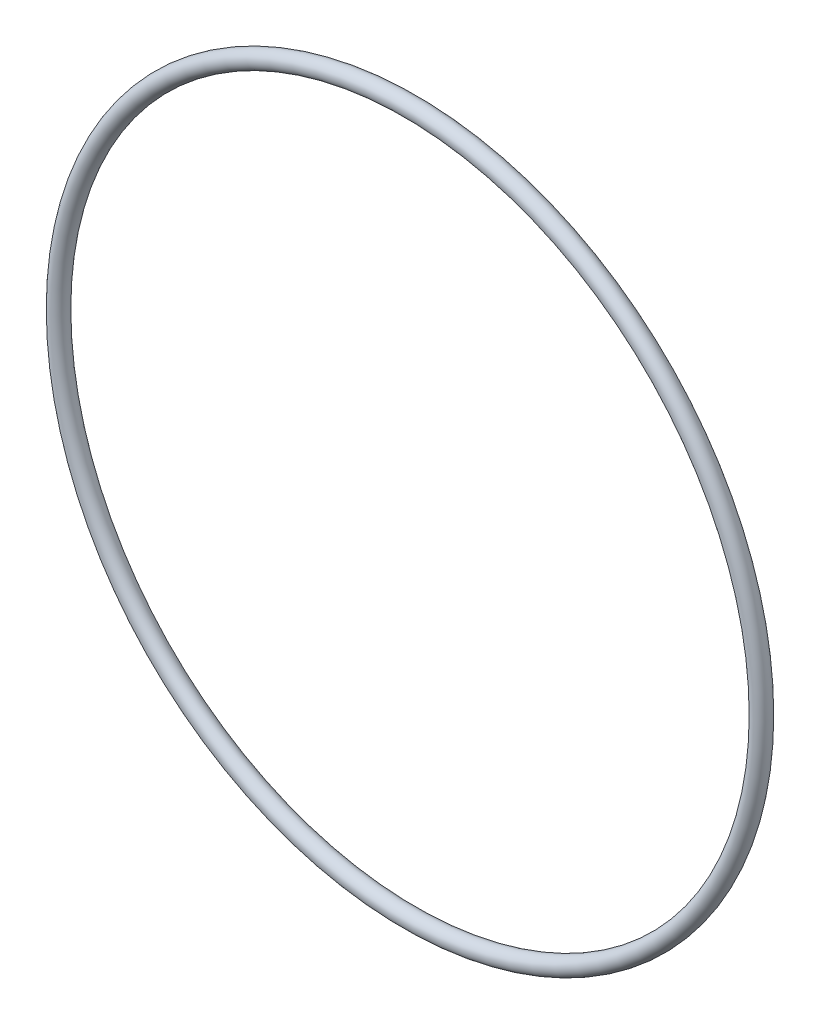
from build123d import *

# Parameters (mm, degrees)
SKETCH2_R = 1.7653


with BuildPart() as part:
    # Sketch2 → Revolve1 (revolve)
    with BuildSketch(Plane(origin=(0, 0, 0), x_dir=(1, 0, 0), z_dir=(0, 1, 0)), mode=Mode.PRIVATE) as revolve1_sk:
        with Locations((-71.4121, 0)):
            Circle(SKETCH2_R)
    revolve(revolve1_sk.sketch.rotate(Axis((0, 0, 1.7653), (0, 0, -1)), 180), axis=Axis((0, 0, 1.7653), (0, 0, -1)))


solid = part.part
